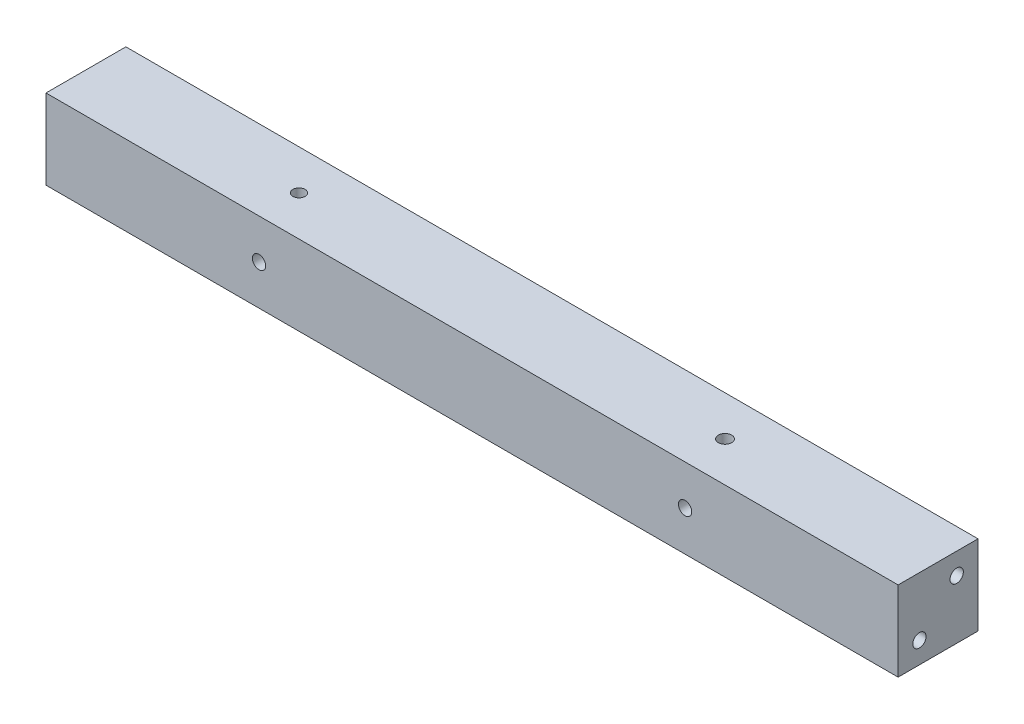
from build123d import *

# Parameters (mm, degrees)
SKETCH1_W           = 160
SKETCH1_H           = 15
BOSS_EXTRUDE1_DEPTH = 15
SKETCH2_R           = 1.25
CUT_EXTRUDE1_DEPTH  = 162.400123916
SKETCH3_R           = 1.145
SKETCH3_R_2         = 1.25
CUT_EXTRUDE2_DEPTH  = 162.400123916
SKETCH6_R           = 1.25
CUT_EXTRUDE5_DEPTH  = 10
CUT_EXTRUDE6_START  = -10
SKETCH7_R           = 1.25
CUT_EXTRUDE6_DEPTH  = 10


with BuildPart() as part:
    # Sketch1 → Boss-Extrude1 (new body)
    with BuildSketch(Plane.XY):
        with Locations((80, 7.5)):
            Rectangle(SKETCH1_W, SKETCH1_H)
    extrude(amount=BOSS_EXTRUDE1_DEPTH)

    # Sketch2 → Cut-Extrude1 (cut, through all)
    with BuildSketch(Plane.XY.offset(15)):
        with Locations((40, 7.5)):
            Circle(SKETCH2_R)
        with Locations((120, 7.5)):
            Circle(SKETCH2_R)
    extrude(amount=-CUT_EXTRUDE1_DEPTH, mode=Mode.SUBTRACT)

    # Sketch3 → Cut-Extrude2 (cut, through all)
    with BuildSketch(Plane(origin=(0, 15, 0), x_dir=(1, 0, 0), z_dir=(0, 1, 0))):
        with Locations(Location((40, -7.5, 0), (0, 0, 270))):
            Circle(SKETCH3_R)
        with Locations(Location((120, -7.5, 0), (0, 0, 270))):
            Circle(SKETCH3_R_2)
    extrude(amount=-CUT_EXTRUDE2_DEPTH, mode=Mode.SUBTRACT)

    # Sketch6 → Cut-Extrude5 (cut)
    with BuildSketch(Plane.ZY):
        with Locations((4, 11)):
            Circle(SKETCH6_R)
        with Locations((11, 4)):
            Circle(SKETCH6_R)
    extrude(amount=-CUT_EXTRUDE5_DEPTH, mode=Mode.SUBTRACT)

    # Sketch7 → Cut-Extrude6 (cut)
    with BuildSketch(Plane(origin=(160, 0, 0), x_dir=(0, 0, -1), z_dir=(1, 0, 0)).offset(CUT_EXTRUDE6_START)):
        with Locations(Location((-4, 11, 0), (0, 0, 180))):
            Circle(SKETCH7_R)
        with Locations(Location((-11, 4, 0), (0, 0, 180))):
            Circle(SKETCH7_R)
    extrude(amount=CUT_EXTRUDE6_DEPTH, mode=Mode.SUBTRACT)


solid = part.part
